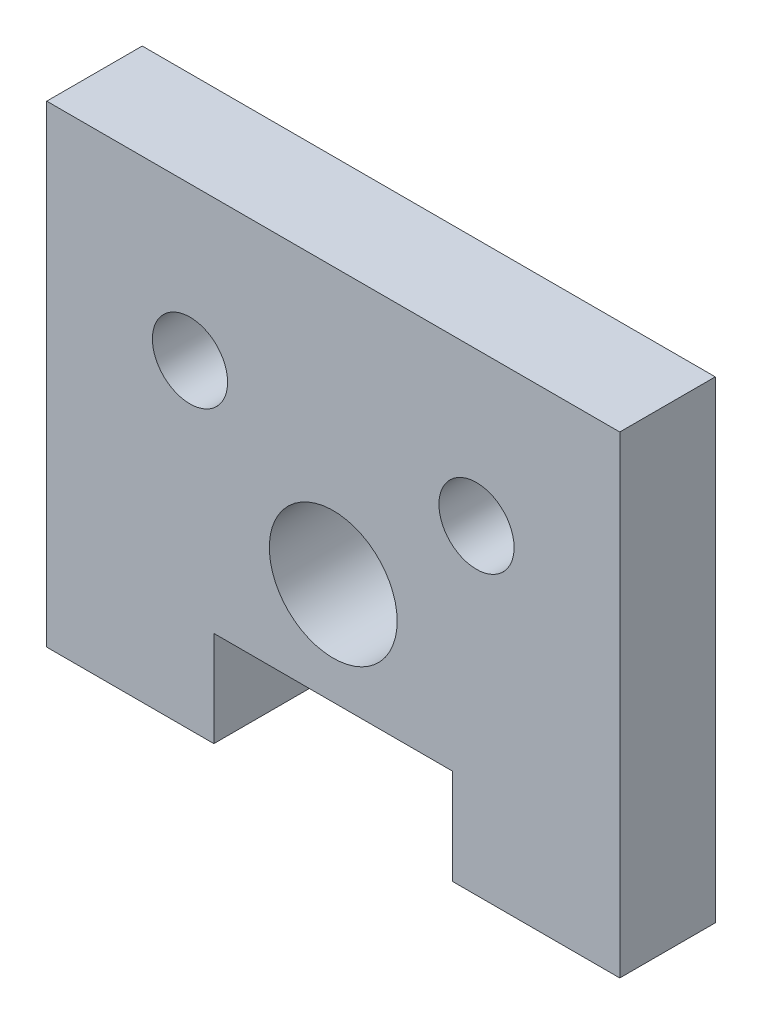
from build123d import *

# Parameters (mm, degrees)
SKETCH1_R           = 5
BOSS_EXTRUDE1_DEPTH = 12.7


with BuildPart() as part:
    # Sketch1 → Boss-Extrude1 (new body)
    with BuildSketch(Plane.XY):
        Polygon((-38.1, -34.544), (-15.875, -34.544), (-15.875, -21.844), (0, -21.844), (15.875, -21.844), (15.875, -34.544), (38.1, -34.544), (38.1, 28.336368082), (-19.05, 28.336368082), (-38.1, 28.336368082), align=None)
        with BuildLine():
            ThreePointArc((8.5, -8.264), (6.01040764, -14.27440764), (0, -16.764))
            ThreePointArc((0, -16.764), (-6.01040764, -2.25359236), (8.5, -8.264))
        make_face(mode=Mode.SUBTRACT)
        with Locations((-19.05, 7.992)):
            Circle(SKETCH1_R, mode=Mode.SUBTRACT)
        with Locations((19.05, 7.992)):
            Circle(SKETCH1_R, mode=Mode.SUBTRACT)
    extrude(amount=BOSS_EXTRUDE1_DEPTH)


solid = part.part
